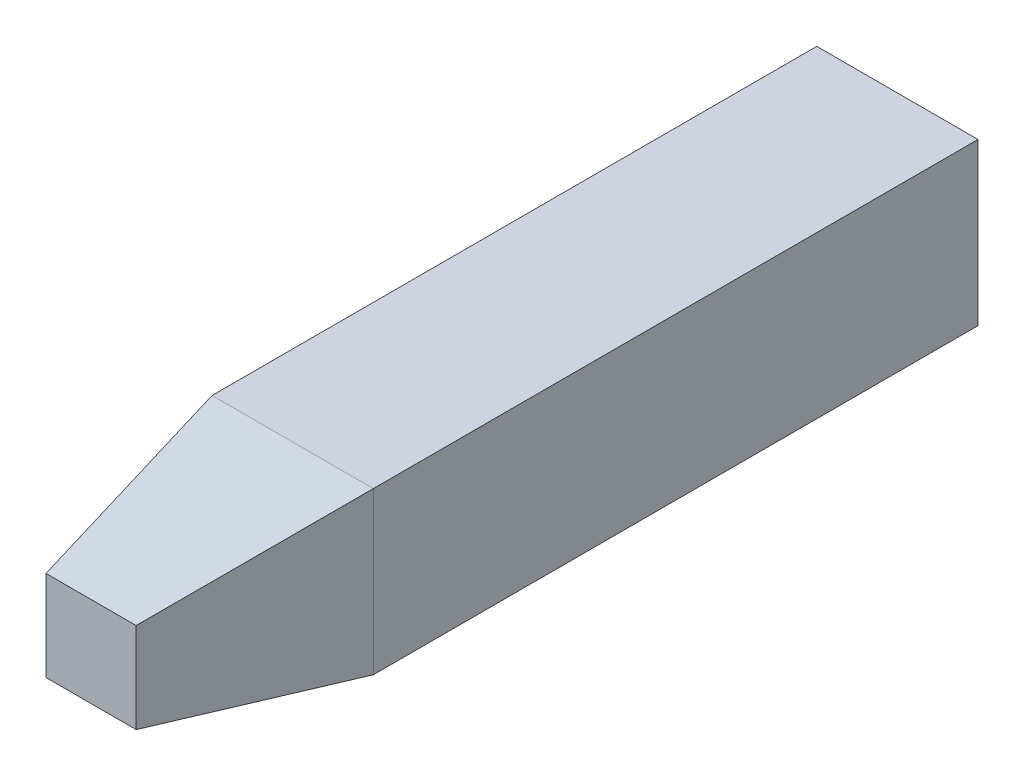
from build123d import *

# Parameters (mm, degrees)
SKETCH1_W           = 8
SKETCH1_H           = 8
BOSS_EXTRUDE1_DEPTH = 30
SKETCH2_W           = 8
SKETCH2_H           = 8
BOSS_EXTRUDE2_DEPTH = 10
BOSS_EXTRUDE2_TAPER = 10


with BuildPart() as part:
    # Sketch1 → Boss-Extrude1 (new body)
    with BuildSketch(Plane.XY):
        Rectangle(SKETCH1_W, SKETCH1_H)
    extrude(amount=BOSS_EXTRUDE1_DEPTH)

    # Sketch2 → Boss-Extrude2 (add)
    with BuildSketch(Plane.XY.offset(30)):
        Rectangle(SKETCH2_W, SKETCH2_H)
    extrude(amount=BOSS_EXTRUDE2_DEPTH, taper=BOSS_EXTRUDE2_TAPER)


solid = part.part
